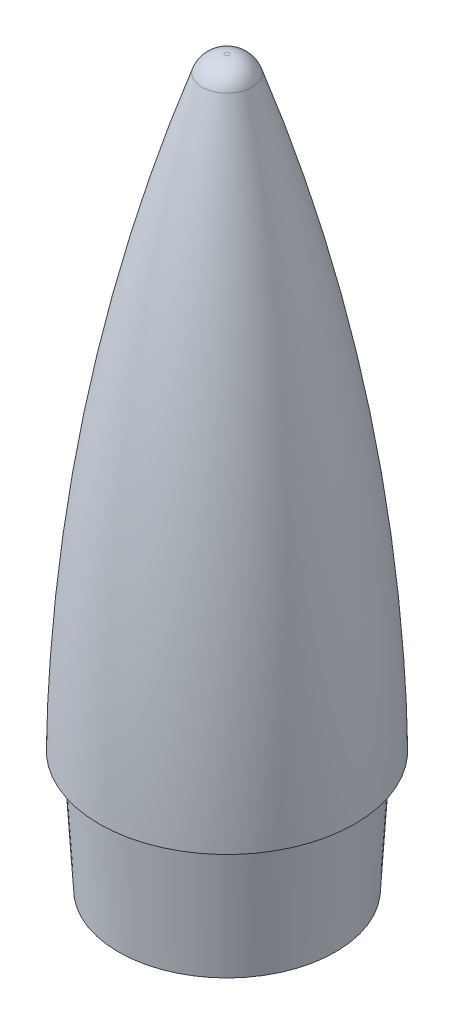
from build123d import *

# Parameters (mm, degrees)
FILLET1_R                = 2.54
FILLET2_R                = 0.508
SKETCH2_R                = 9.525
CUT_EXTRUDE1_DEPTH       = 25.4
CUT_EXTRUDE1_DRAFT       = -3
FILLET3_R                = 7.62
BOSS_EXTRUDE2_DEPTH      = 1.905
BOSS_EXTRUDE2_DEPTH_BACK = 1.905
SKETCH4_W                = 19.05
SKETCH4_H                = 2.54
FILLET4_R                = 1.27


with BuildPart() as part:
    # Sketch1 → Revolve1 (revolve)
    with BuildSketch(Plane.XY, mode=Mode.PRIVATE) as revolve1_sk:
        with BuildLine():
            Line((0, 0), (-11.43, 0))
            Line((-11.43, 0), (-12.192, 12.7))
            Line((-12.192, 12.7), (-13.462, 12.7))
            ThreePointArc((-13.462, 12.7), (-10.325866136, 44.914195904), (-2.032, 76.2))
            Line((-2.032, 76.2), (0, 76.2))
            Line((0, 76.2), (0, 0))
        make_face()
    revolve(revolve1_sk.sketch.rotate(Axis((0, 76.2, 0), (0, -1, 0)), 270), axis=Axis((0, 76.2, 0), (0, -1, 0)))

    # Fillet1
    fillet1_edges = [part.edges().sort_by_distance(p)[0] for p in [
        (0, 76.2, -2.032),
    ]]
    fillet(fillet1_edges, radius=FILLET1_R)

    # Fillet2
    fillet2_edges = [part.edges().sort_by_distance(p)[0] for p in [
        (0, 12.7, -12.192),
    ]]
    fillet(fillet2_edges, radius=FILLET2_R)


with BuildPart() as cut_extrude1_tool:
    # Sketch2 → Cut-Extrude1 (with draft: the straight prism first)
    with BuildSketch(Plane.XZ):
        Circle(SKETCH2_R)
    extrude(amount=-CUT_EXTRUDE1_DEPTH)
    # Cut-Extrude1: the draft: its side faces are tilted about the plane it starts from
    cut_extrude1_sides = [cut_extrude1_tool.faces().sort_by_distance(p)[0] for p in [
        (-9.525, 12.7, 0),
    ]]
    draft(cut_extrude1_sides, Plane.XZ, CUT_EXTRUDE1_DRAFT)


with BuildPart() as part_1:
    add(part.part)

    # Cut-Extrude1: cut by cut_extrude1_tool
    add(cut_extrude1_tool.part, mode=Mode.SUBTRACT)

    # Fillet3
    fillet3_edges = [part_1.edges().sort_by_distance(p)[0] for p in [
        (-8.193842406, 25.4, 0),
    ]]
    fillet(fillet3_edges, radius=FILLET3_R)

    # Sketch4 → Boss-Extrude2 (add, two sides: drawn at the far end of the back side and taken through both)
    with BuildSketch(Plane.XY.offset(-BOSS_EXTRUDE2_DEPTH_BACK)):
        with Locations((0, 1.27)):
            Rectangle(SKETCH4_W, SKETCH4_H)
    extrude(amount=BOSS_EXTRUDE2_DEPTH + BOSS_EXTRUDE2_DEPTH_BACK)

    # Fillet4
    fillet4_edges = [part_1.edges().sort_by_distance(p)[0] for p in [
        (9.264615578, 1.270000539, 1.905),
        (9.264615578, 1.270000539, -1.905),
        (-9.264615578, 1.270000539, 1.905),
        (-9.264615578, 1.270000539, -1.905),
    ]]
    fillet(fillet4_edges, radius=FILLET4_R)


solid = part_1.part
